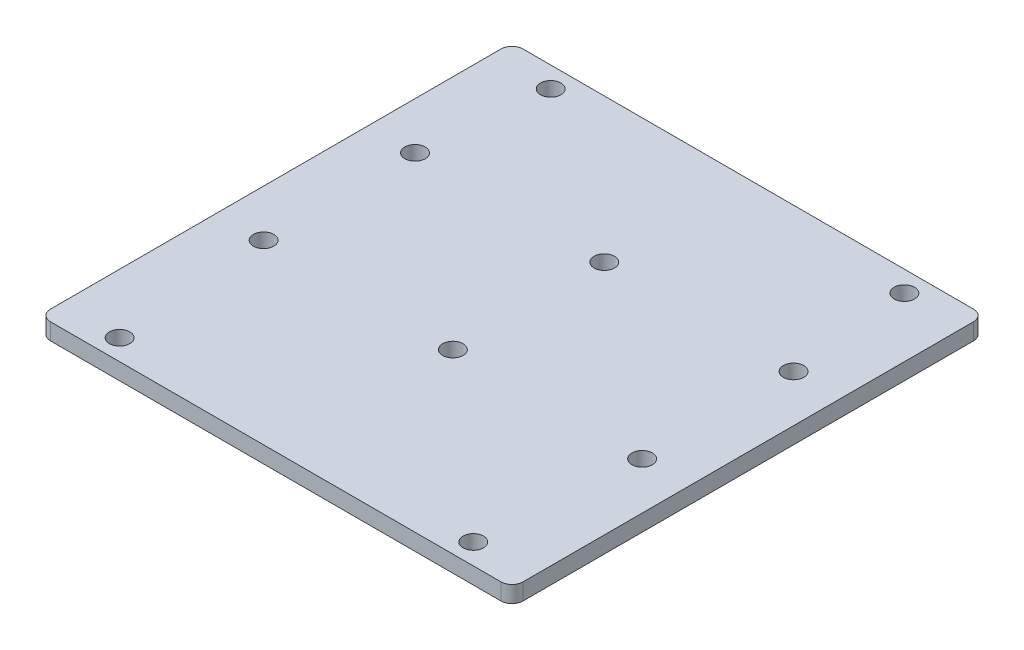
from build123d import *

# Parameters (mm, degrees)
SKETCH1_W           = 85.5
SKETCH1_H           = 85.5
BOSS_EXTRUDE1_DEPTH = 3
FILLET1_R           = 2
SKETCH2_R           = 1.85
CUT_EXTRUDE1_DEPTH  = 10
SKETCH3_R           = 1.85
CUT_EXTRUDE2_DEPTH  = 5


with BuildPart() as part:
    # Sketch1 → Boss-Extrude1 (new body)
    with BuildSketch(Plane(origin=(0, 0, 0), x_dir=(1, 0, 0), z_dir=(0, 1, 0))):
        Rectangle(SKETCH1_W, SKETCH1_H)
    extrude(amount=BOSS_EXTRUDE1_DEPTH)

    # Fillet1
    fillet1_edges = [part.edges().sort_by_distance(p)[0] for p in [
        (-42.75, 1.5, -42.75),
        (42.75, 1.5, -42.75),
        (42.75, 1.5, 42.75),
        (-42.75, 1.5, 42.75),
    ]]
    fillet(fillet1_edges, radius=FILLET1_R)

    # Sketch2 → Cut-Extrude1 (cut)
    with BuildSketch(Plane.XZ):
        with Locations(Location((-32, -39, 0), (0, 0, 270))):
            Circle(SKETCH2_R)
        with Locations(Location((32, -39, 0), (0, 0, 270))):
            Circle(SKETCH2_R)
        with Locations(Location((-32, 39, 0), (0, 0, 270))):
            Circle(SKETCH2_R)
        with Locations(Location((32, 39, 0), (0, 0, 270))):
            Circle(SKETCH2_R)
    extrude(amount=-CUT_EXTRUDE1_DEPTH, mode=Mode.SUBTRACT)

    # Sketch3 → Cut-Extrude2 (cut)
    with BuildSketch(Plane.XZ):
        with Locations(Location((-34.25, -16.7, 0), (0, 0, 270))):
            Circle(SKETCH3_R)
        with Locations(Location((0, -16.7, 0), (0, 0, 270))):
            Circle(SKETCH3_R)
        with Locations(Location((34.25, -16.7, 0), (0, 0, 270))):
            Circle(SKETCH3_R)
        with Locations(Location((0, 10.7, 0), (0, 0, 270))):
            Circle(SKETCH3_R)
        with Locations(Location((-34.25, 10.7, 0), (0, 0, 270))):
            Circle(SKETCH3_R)
        with Locations(Location((34.25, 10.7, 0), (0, 0, 270))):
            Circle(SKETCH3_R)
    extrude(amount=-CUT_EXTRUDE2_DEPTH, mode=Mode.SUBTRACT)


solid = part.part
